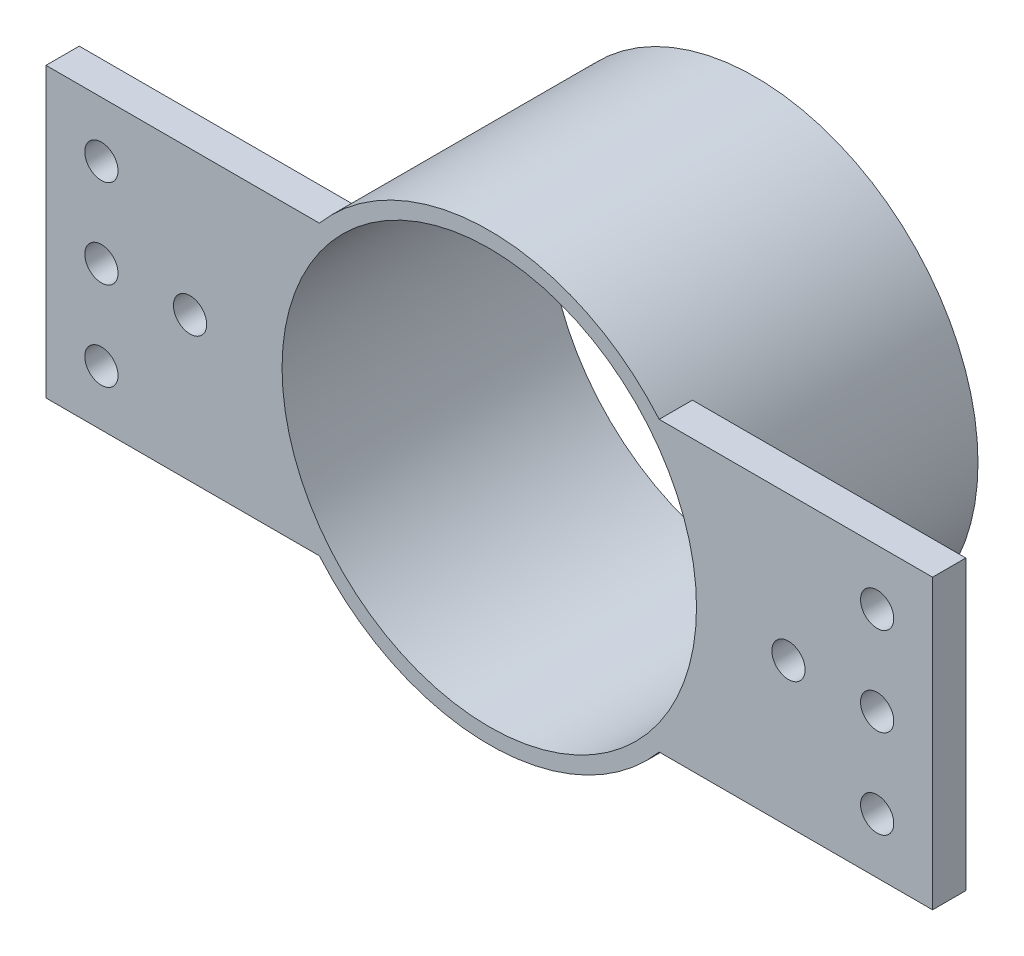
from build123d import *

# Parameters (mm, degrees)
SKETCH_1_W          = 80
SKETCH_1_H          = 26
SKETCH_1_R          = 1.5
EXTRUDE_1_DEPTH     = 3
SKETCH_2_R          = 20.1
EXTRUDE_2_DEPTH     = 24
SKETCH_3_R          = 18.7
CUT_EXTRUDE_1_DEPTH = 25


with BuildPart() as part:
    # 草图1 → 凸台-拉伸1 (new body)
    with BuildSketch(Plane.XY):
        Rectangle(SKETCH_1_W, SKETCH_1_H)
        with Locations((-35, 0)):
            Circle(SKETCH_1_R, mode=Mode.SUBTRACT)
        with Locations((-27, 0)):
            Circle(SKETCH_1_R, mode=Mode.SUBTRACT)
        with Locations((-35, 8)):
            Circle(SKETCH_1_R, mode=Mode.SUBTRACT)
        with Locations((-35, -8)):
            Circle(SKETCH_1_R, mode=Mode.SUBTRACT)
        with Locations(Location((35, -8, 0), (0, 0, 180))):
            Circle(SKETCH_1_R, mode=Mode.SUBTRACT)
        with Locations(Location((35, 8, 0), (0, 0, 180))):
            Circle(SKETCH_1_R, mode=Mode.SUBTRACT)
        with Locations(Location((35, 0, 0), (0, 0, 180))):
            Circle(SKETCH_1_R, mode=Mode.SUBTRACT)
        with Locations(Location((27, 0, 0), (0, 0, 180))):
            Circle(SKETCH_1_R, mode=Mode.SUBTRACT)
    extrude(amount=EXTRUDE_1_DEPTH)

    # 草图2 → 凸台-拉伸2 (add)
    with BuildSketch(Plane.XY.offset(3)):
        Circle(SKETCH_2_R)
    extrude(amount=-EXTRUDE_2_DEPTH)

    # 草图3 → 切除-拉伸1 (cut)
    with BuildSketch(Plane(origin=(0, 0, -21), x_dir=(-1, 0, 0), z_dir=(0, 0, -1))):
        Circle(SKETCH_3_R)
    extrude(amount=-CUT_EXTRUDE_1_DEPTH, mode=Mode.SUBTRACT)


solid = part.part
